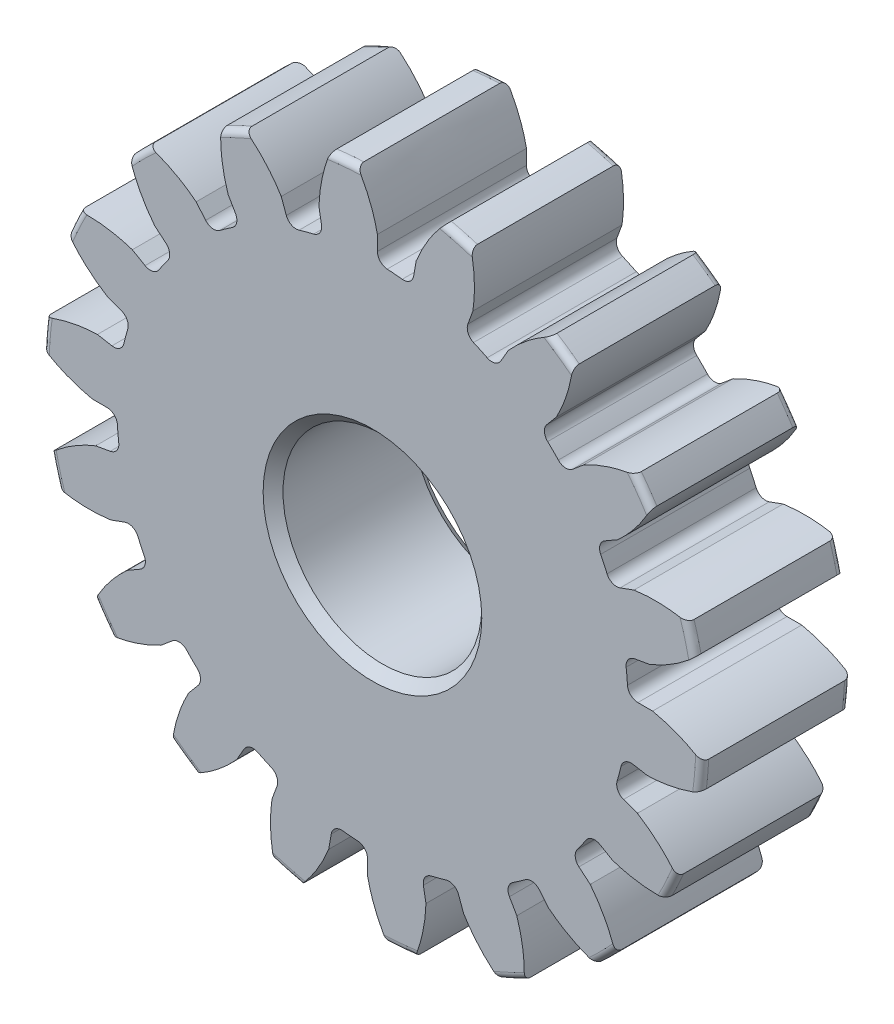
from build123d import *

# Parameters (mm, degrees)
SKETCH1_R                = 10.541
BOSS_EXTRUDE1_DEPTH      = 4.7625
SKETCH2_W                = 6.3373
SKETCH2_H                = 6.35
FILLET2_R                = 0.21082
CUT_EXTRUDE1_DEPTH       = 19.585772146
FILLET1_R                = 0.332486
CIRPATTERN1_COUNT        = 18
FILLET1_OF_CIRPATTERN1_R = 0.332486
SKETCH5_R                = 3.175
CUT_EXTRUDE2_DEPTH       = 19.572998108
SKETCH6_R                = 9.525
CUT_EXTRUDE3_DEPTH       = 17.183697661
CHAMFER1_SIZE            = 0.3175


with BuildPart() as part:
    # Sketch1 → Boss-Extrude1 (new body)
    with BuildSketch(Plane.XY):
        Circle(SKETCH1_R)
    extrude(amount=-BOSS_EXTRUDE1_DEPTH)

    # Sketch2 → Revolve1 (revolve)
    with BuildSketch(Plane(origin=(0, 0, 0), x_dir=(0, 0, -1), z_dir=(1, 0, 0)), mode=Mode.PRIVATE) as revolve1_sk:
        with Locations((7.93115, 3.175)):
            Rectangle(SKETCH2_W, SKETCH2_H)
    revolve(revolve1_sk.sketch.rotate(Axis((0, 0, -4.7625), (0, 0, -1)), 90), axis=Axis((0, 0, -4.7625), (0, 0, -1)))

    # Fillet2
    fillet2_edges = [part.edges().sort_by_distance(p)[0] for p in [
        (-10.541, 0, 0),
        (-10.541, 0, -4.7625),
        (-6.35, 0, -4.7625),
    ]]
    fillet(fillet2_edges, radius=FILLET2_R)

    # Sketch4 → Cut-Extrude1 (cut, through all)
    with BuildSketch(Plane.XY):
        with BuildLine():
            Line((0.157561629, 8.949185285), (0.157561629, 8.158228631))
            ThreePointArc((0.157561629, 8.158228631), (0.711170731, 8.128699543), (1.261496911, 8.061646582))
            Line((1.261496911, 8.061646582), (1.398845411, 8.840586771))
            add(Edge.make_bspline(
                [(4.497758077, 11.696351513), (2.192075376, 10.823747212), (1.398845411, 8.840586771)],
                knots=[0, 0, 0, 1, 1, 1], degree=2))
            ThreePointArc((4.497758077, 11.696351513), (1.092180738, 12.483653619), (-2.39837188, 12.299686125))
            add(Edge.make_bspline(
                [(-2.39837188, 12.299686125), (-0.279244341, 11.039960179), (0.157561629, 8.949185285)],
                knots=[0, 0, 0, 1, 1, 1], degree=2))
        make_face()
    cut_extrude1 = extrude(amount=-CUT_EXTRUDE1_DEPTH, mode=Mode.SUBTRACT)

    # Fillet1
    fillet1_edges = [part.edges().sort_by_distance(p)[0] for p in [
        (1.261496911, 8.061646582, -2.38125),
        (0.157561629, 8.158228631, -2.38125),
    ]]
    fillet(fillet1_edges, radius=FILLET1_R)

    # CirPattern1: Cut-Extrude1 ×18 about axis
    cirpattern1_axis = Axis((0, 0, -4.7625), (0, 0, 1))
    for i in range(1, CIRPATTERN1_COUNT):
        add(cut_extrude1.rotate(cirpattern1_axis, i * 360 / CIRPATTERN1_COUNT), mode=Mode.SUBTRACT)

    # Fillet1 of CirPattern1
    fillet1_of_cirpattern1_edges = [part.edges().sort_by_distance(p)[0] for p in [
        (-1.57182618, 8.006927158, -2.38125),
        (-2.642219026, 7.720116494, -2.38125),
        (-4.215563837, 6.98645415, -2.38125),
        (-5.123309071, 6.350844371, -2.38125),
        (-6.35084228, 5.123311663, -2.38125),
        (-6.98645243, 4.215566689, -2.38125),
        (-7.720115416, 2.642222177, -2.38125),
        (-8.006926517, 1.571829448, -2.38125),
        (-8.158228695, -0.157558299, -2.38125),
        (-8.061647096, -1.261493621, -2.38125),
        (-7.612339192, -2.938334919, -2.38125),
        (-7.144014059, -3.942661942, -2.38125),
        (-6.148289235, -5.364704982, -2.38125),
        (-5.364707491, -6.148287046, -2.38125),
        (-3.942664858, -7.14401245, -2.38125),
        (-2.938338026, -7.612337992, -2.38125),
        (-1.261496911, -8.061646582, -2.38125),
        (-0.157561629, -8.158228631, -2.38125),
        (1.57182618, -8.006927158, -2.38125),
        (2.642219026, -7.720116494, -2.38125),
        (4.215563837, -6.98645415, -2.38125),
        (5.123309071, -6.350844371, -2.38125),
        (6.35084228, -5.123311663, -2.38125),
        (6.98645243, -4.215566689, -2.38125),
        (7.720115416, -2.642222177, -2.38125),
        (8.006926517, -1.571829448, -2.38125),
        (8.158228695, 0.157558299, -2.38125),
        (8.061647096, 1.261493621, -2.38125),
        (7.612339192, 2.938334919, -2.38125),
        (7.144014059, 3.942661942, -2.38125),
        (6.148289235, 5.364704982, -2.38125),
        (5.364707491, 6.148287046, -2.38125),
        (3.942664858, 7.14401245, -2.38125),
        (2.938338026, 7.612337992, -2.38125),
    ]]
    fillet(fillet1_of_cirpattern1_edges, radius=FILLET1_OF_CIRPATTERN1_R)

    # Sketch5 → Cut-Extrude2 (cut, through all)
    with BuildSketch(Plane.XY):
        Circle(SKETCH5_R)
    extrude(amount=-CUT_EXTRUDE2_DEPTH, mode=Mode.SUBTRACT)

    # Sketch6 → Cut-Extrude3 (cut, through all)
    with BuildSketch(Plane(origin=(0, 0, -4.7625), x_dir=(-1, 0, 0), z_dir=(0, 0, -1))):
        Circle(SKETCH6_R)
    extrude(amount=CUT_EXTRUDE3_DEPTH, mode=Mode.SUBTRACT)

    # Chamfer1
    chamfer1_edges = [part.edges().sort_by_distance(p)[0] for p in [
        (-3.175, 0, 0),
        (-3.175, 0, -4.7625),
    ]]
    chamfer(chamfer1_edges, length=CHAMFER1_SIZE)


solid = part.part
